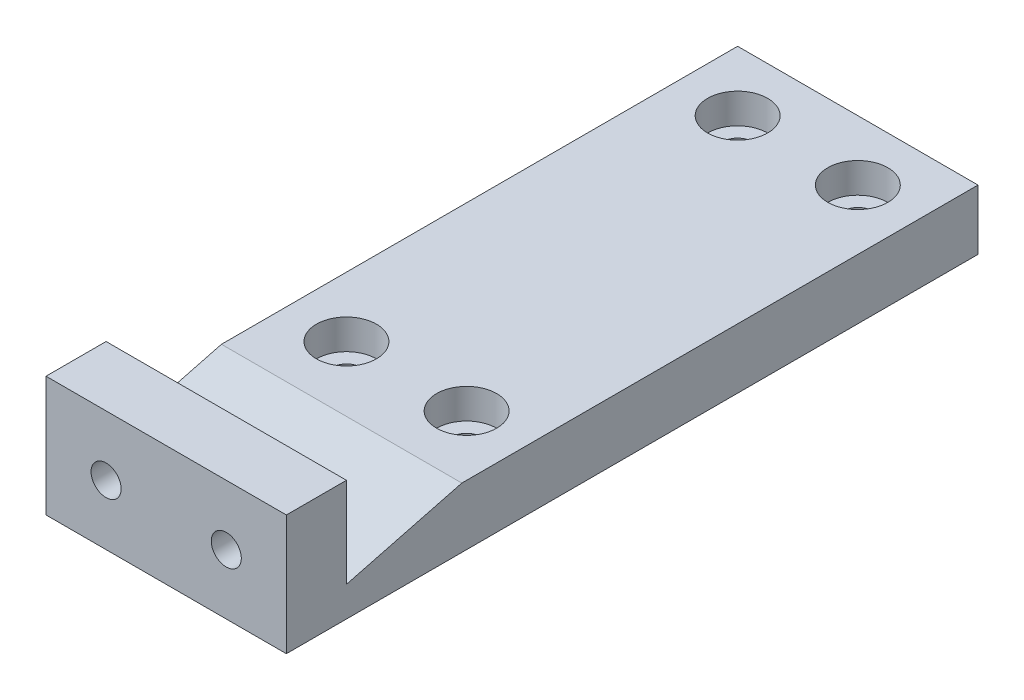
from build123d import *

# Parameters (mm, degrees)
SKETCH1_W               = 40
SKETCH1_H               = 115.1
BOSS_EXTRUDE1_DEPTH     = 10
SKETCH2_W               = 40
SKETCH2_H               = 10
BOSS_EXTRUDE2_DEPTH     = 10
CUT_EXTRUDE1_DEPTH      = 62.741416407
CUT_EXTRUDE1_DEPTH_BACK = 62.741416407
SKETCH3_R               = 2.5
SKETCH4_R               = 5
CUT_EXTRUDE2_DEPTH      = 5
CUT_EXTRUDE3_DEPTH      = 73.883485784
CUT_EXTRUDE3_DEPTH_BACK = 73.883485784
SKETCH6_R               = 2.5
CUT_EXTRUDE4_DEPTH      = 109.839377065
SKETCH7_R               = 5
CUT_EXTRUDE5_DEPTH      = 5


with BuildPart() as part:
    # Sketch1 → Boss-Extrude1 (new body)
    with BuildSketch(Plane(origin=(0, 0, 0), x_dir=(1, 0, 0), z_dir=(0, 1, 0))):
        Rectangle(SKETCH1_W, SKETCH1_H)
    extrude(amount=BOSS_EXTRUDE1_DEPTH)

    # Sketch2 → Boss-Extrude2 (add)
    with BuildSketch(Plane(origin=(0, 10, 0), x_dir=(1, 0, 0), z_dir=(0, 1, 0))):
        with Locations((0, -52.55)):
            Rectangle(SKETCH2_W, SKETCH2_H)
    extrude(amount=BOSS_EXTRUDE2_DEPTH)

    # Sketch3 → Cut-Extrude1 (cut, two sides: drawn at the far end of the back side and taken through both)
    with BuildSketch(Plane(origin=(0, 10, 0), x_dir=(1, 0, 0), z_dir=(0, 1, 0)).offset(-CUT_EXTRUDE1_DEPTH_BACK)):
        with Locations(Location((-10, 47.55, 0), (0, 0, 270))):
            Circle(SKETCH3_R)
        with Locations(Location((10, 47.55, 0), (0, 0, 270))):
            Circle(SKETCH3_R)
        with Locations(Location((10, -17.55, 0), (0, 0, 270))):
            Circle(SKETCH3_R)
        with Locations(Location((-10, -17.55, 0), (0, 0, 270))):
            Circle(SKETCH3_R)
    extrude(amount=CUT_EXTRUDE1_DEPTH + CUT_EXTRUDE1_DEPTH_BACK, mode=Mode.SUBTRACT)

    # Sketch4 → Cut-Extrude2 (cut)
    with BuildSketch(Plane(origin=(0, 10, 0), x_dir=(1, 0, 0), z_dir=(0, 1, 0))):
        with Locations(Location((10, 47.55, 0), (0, 0, 270))):
            Circle(SKETCH4_R)
        with Locations(Location((-10, 47.55, 0), (0, 0, 270))):
            Circle(SKETCH4_R)
        with Locations(Location((10, -17.55, 0), (0, 0, 270))):
            Circle(SKETCH4_R)
        with Locations(Location((-10, -17.55, 0), (0, 0, 270))):
            Circle(SKETCH4_R)
    extrude(amount=-CUT_EXTRUDE2_DEPTH, mode=Mode.SUBTRACT)

    # Sketch5 → Cut-Extrude3 (cut, two sides: drawn at the far end of the back side and taken through both)
    with BuildSketch(Plane.ZY.offset(20).offset(-CUT_EXTRUDE3_DEPTH_BACK)):
        Polygon((28.35, 10), (47.55, 5), (47.55, 10), align=None)
    extrude(amount=CUT_EXTRUDE3_DEPTH + CUT_EXTRUDE3_DEPTH_BACK, mode=Mode.SUBTRACT)

    # Sketch6 → Cut-Extrude4 (cut, through all)
    with BuildSketch(Plane(origin=(0, 0, 47.55), x_dir=(-1, 0, 0), z_dir=(0, 0, -1))):
        with Locations((-10, 10)):
            Circle(SKETCH6_R)
        with Locations((10, 10)):
            Circle(SKETCH6_R)
    extrude(amount=-CUT_EXTRUDE4_DEPTH, mode=Mode.SUBTRACT)

    # Sketch7 → Cut-Extrude5 (cut)
    with BuildSketch(Plane(origin=(0, 0, 47.55), x_dir=(-1, 0, 0), z_dir=(0, 0, -1))):
        with Locations((-10, 10)):
            Circle(SKETCH7_R)
        with Locations((10, 10)):
            Circle(SKETCH7_R)
    extrude(amount=-CUT_EXTRUDE5_DEPTH, mode=Mode.SUBTRACT)


solid = part.part
